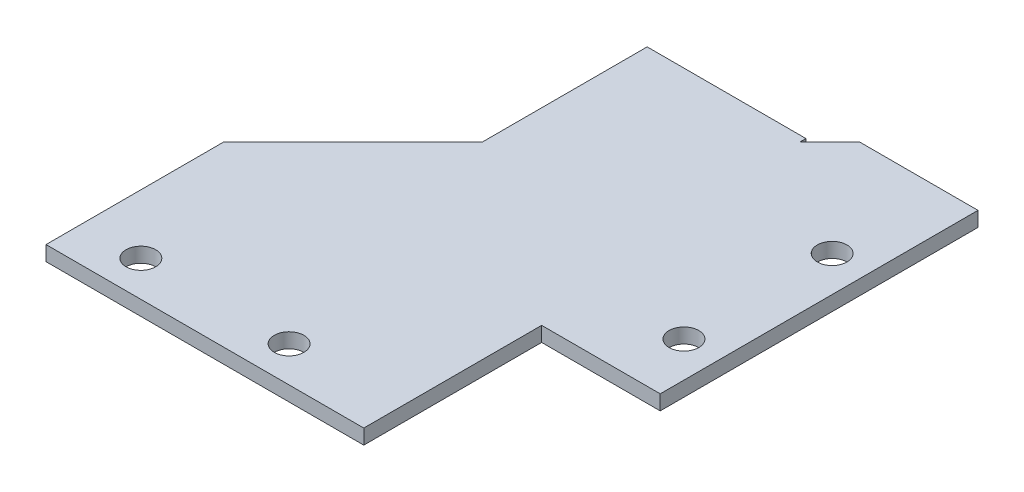
from build123d import *

# Parameters (mm, degrees)
SKETCH1_W           = 68.072
SKETCH1_H           = 38.1
SKETCH1_W_2         = 25.4
SKETCH1_H_2         = 68.072
BOSS_EXTRUDE1_DEPTH = 3.175
SKETCH2_R           = 3.175
CUT_EXTRUDE1_DEPTH  = 142.490596836
SKETCH3_W           = 34.0106
SKETCH3_H           = 54.542014323
BOSS_EXTRUDE2_DEPTH = 3.175


with BuildPart() as part:
    # Sketch1 → Boss-Extrude1 (new body)
    with BuildSketch(Plane(origin=(0, 0, 0), x_dir=(1, 0, 0), z_dir=(0, 1, 0))):
        with Locations((34.036, 19.05)):
            Rectangle(SKETCH1_W, SKETCH1_H)
        Polygon((68.072, 106.172), (68.072, 38.1), (0, 38.1), align=None)
        with Locations((80.772, 72.136)):
            Rectangle(SKETCH1_W_2, SKETCH1_H_2)
    extrude(amount=BOSS_EXTRUDE1_DEPTH)

    # Sketch2 → Cut-Extrude1 (cut, through all)
    with BuildSketch(Plane(origin=(0, 3.175, 0), x_dir=(1, 0, 0), z_dir=(0, 1, 0))):
        with Locations(Location((12.7, 7.62, 0), (0, 0, 270))):
            Circle(SKETCH2_R)
        with Locations(Location((44.45, 7.62, 0), (0, 0, 270))):
            Circle(SKETCH2_R)
        with Locations(Location((85.852, 50.8, 0), (0, 0, 270))):
            Circle(SKETCH2_R)
        with Locations(Location((85.852, 82.55, 0), (0, 0, 270))):
            Circle(SKETCH2_R)
    extrude(amount=-CUT_EXTRUDE1_DEPTH, mode=Mode.SUBTRACT)

    # Sketch3 → Boss-Extrude2 (add)
    with BuildSketch(Plane(origin=(0, 3.175, 0), x_dir=(1, 0, 0), z_dir=(0, 1, 0))):
        with Locations((44.7167, 73.793637407)):
            Rectangle(SKETCH3_W, SKETCH3_H)
    extrude(amount=-BOSS_EXTRUDE2_DEPTH)


solid = part.part
